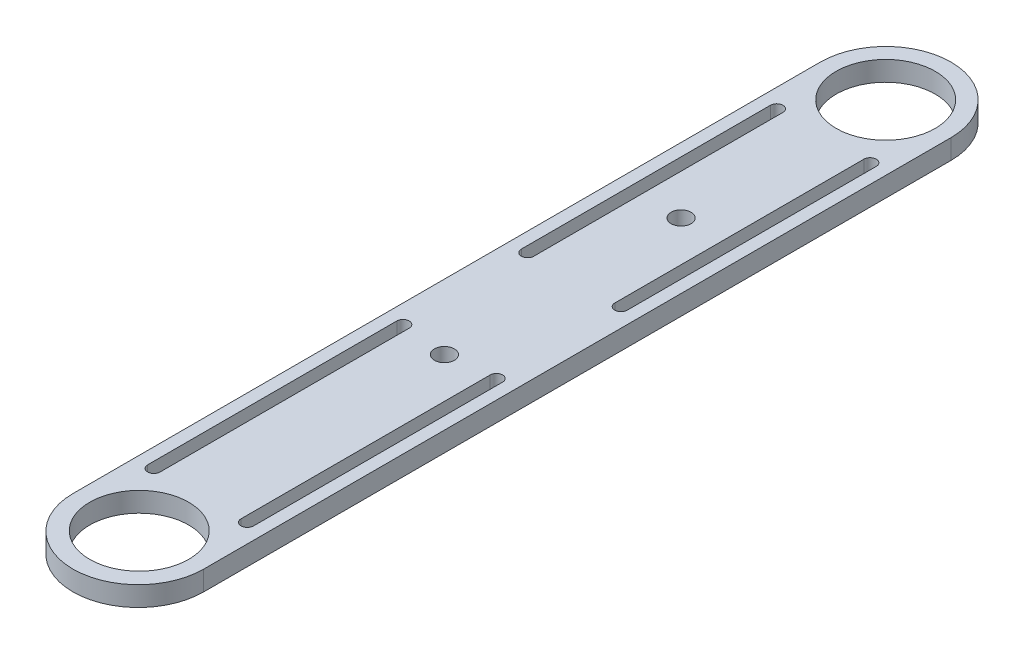
from build123d import *

# Parameters (mm, degrees)
BOSS_EXTRUDE1_DEPTH     = 3.175
CUT_EXTRUDE2_DEPTH      = 131.960225355
CUT_EXTRUDE2_DEPTH_BACK = 131.960225355
CUT_EXTRUDE4_DEPTH      = 131.960225355
CUT_EXTRUDE4_DEPTH_BACK = 131.960225355
SKETCH5_R               = 7.95
SKETCH8_R               = 1.6
CUT_EXTRUDE6_DEPTH      = 10


with BuildPart() as part:
    # Sketch1 → Boss-Extrude1 (new body)
    with BuildSketch(Plane(origin=(0, 0, 0), x_dir=(1, 0, 0), z_dir=(0, 1, 0))):
        with BuildLine():
            Line((-10.5, 0), (-10.5, -120))
            ThreePointArc((-10.5, -120), (0, -130.5), (10.5, -120))
            Line((10.5, -120), (10.5, 0))
            ThreePointArc((10.5, 0), (0, 10.5), (-10.5, 0))
        make_face()
    extrude(amount=BOSS_EXTRUDE1_DEPTH)

    # Sketch3 → Cut-Extrude2 (cut, two sides: drawn at the far end of the back side and taken through both)
    with BuildSketch(Plane.XZ.offset(-CUT_EXTRUDE2_DEPTH_BACK)):
        with BuildLine():
            Line((-8.5, 110), (-8.5, 70))
            ThreePointArc((-8.5, 70), (-7.5, 69), (-6.5, 70))
            Line((-6.5, 70), (-6.5, 110))
            ThreePointArc((-6.5, 110), (-7.5, 111), (-8.5, 110))
        make_face()
        with BuildLine():
            Line((6.5, 110), (6.5, 70))
            ThreePointArc((6.5, 70), (7.5, 69), (8.5, 70))
            Line((8.5, 70), (8.5, 110))
            ThreePointArc((8.5, 110), (7.5, 111), (6.5, 110))
        make_face()
        with BuildLine():
            Line((8.5, 10), (8.5, 50))
            ThreePointArc((8.5, 50), (7.5, 51), (6.5, 50))
            Line((6.5, 50), (6.5, 10))
            ThreePointArc((6.5, 10), (7.5, 9), (8.5, 10))
        make_face()
        with BuildLine():
            Line((-8.5, 50), (-8.5, 10))
            ThreePointArc((-8.5, 10), (-7.5, 9), (-6.5, 10))
            Line((-6.5, 10), (-6.5, 50))
            ThreePointArc((-6.5, 50), (-7.5, 51), (-8.5, 50))
        make_face()
    extrude(amount=CUT_EXTRUDE2_DEPTH + CUT_EXTRUDE2_DEPTH_BACK, mode=Mode.SUBTRACT)

    # Sketch5 → Cut-Extrude4 (cut, two sides: drawn at the far end of the back side and taken through both)
    with BuildSketch(Plane(origin=(0, 3.175, 0), x_dir=(1, 0, 0), z_dir=(0, 1, 0)).offset(-CUT_EXTRUDE4_DEPTH_BACK)):
        with Locations(Location((0, 0, 0), (0, 0, 270))):
            Circle(SKETCH5_R)
        with Locations(Location((-0.003223035, -119.850034657, 0), (0, 0, 270))):
            Circle(SKETCH5_R)
    extrude(amount=CUT_EXTRUDE4_DEPTH + CUT_EXTRUDE4_DEPTH_BACK, mode=Mode.SUBTRACT)

    # Sketch8 → Cut-Extrude6 (cut)
    with BuildSketch(Plane(origin=(0, 3.175, 0), x_dir=(1, 0, 0), z_dir=(0, 1, 0))):
        with Locations(Location((0, -32.85, 0), (0, 0, 270))):
            Circle(SKETCH8_R)
        with Locations(Location((0, -70.85, 0), (0, 0, 270))):
            Circle(SKETCH8_R)
    extrude(amount=-CUT_EXTRUDE6_DEPTH, mode=Mode.SUBTRACT)


solid = part.part
